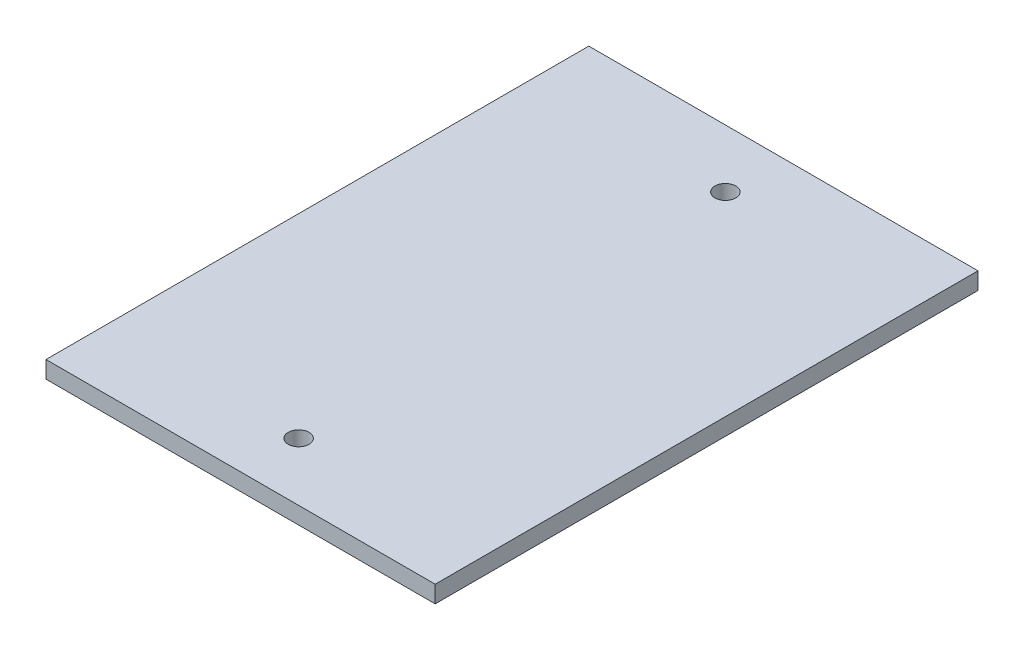
from build123d import *

# Parameters (mm, degrees)
SKETCH1_W           = 57.912
SKETCH1_H           = 80.772
BOSS_EXTRUDE1_DEPTH = 2.54
SKETCH5_R           = 1.55
CUT_EXTRUDE1_DEPTH  = 2.54


with BuildPart() as part:
    # Sketch1 → Boss-Extrude1 (new body)
    with BuildSketch(Plane(origin=(0, 0, 0), x_dir=(1, 0, 0), z_dir=(0, 1, 0))):
        Rectangle(SKETCH1_W, SKETCH1_H)
    extrude(amount=BOSS_EXTRUDE1_DEPTH)

    # Sketch5 → Cut-Extrude1 (cut)
    with BuildSketch(Plane(origin=(0, 2.54, 0), x_dir=(1, 0, 0), z_dir=(0, 1, 0))):
        with Locations((0, -31.75)):
            Circle(SKETCH5_R)
        with Locations((0, 31.75)):
            Circle(SKETCH5_R)
    extrude(amount=-CUT_EXTRUDE1_DEPTH, mode=Mode.SUBTRACT)


solid = part.part
